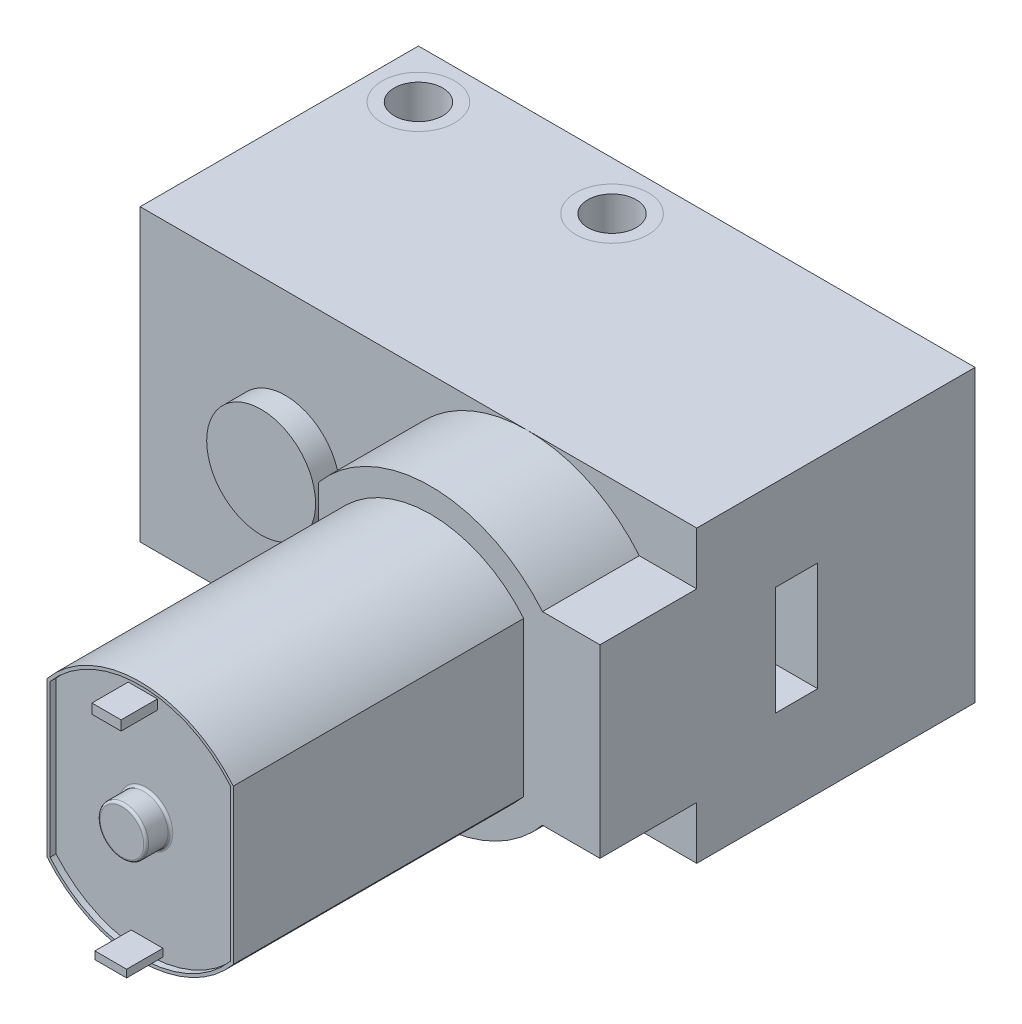
from build123d import *

# Parameters (mm, degrees)
SKETCH_1_W            = 46
SKETCH_1_H            = 23
EXTRUDE_1_DEPTH       = 24
EXTRUDE_2_DEPTH       = 8
EXTRUDE_3_DEPTH       = 24
SKETCH_4_R            = 4.5
SKETCH_4_R_2          = 2
EXTRUDE_4_DEPTH       = 2
SKETCH_6_W            = 3.5
SKETCH_6_H            = 9
CUT_EXTRUDE_1_DEPTH   = 5
SKETCH_7_R            = 2.7
EXTRUDE_5_DEPTH       = 2
EXTRUDE_6_DEPTH       = 7
SKETCH_9_R            = 1.25
CUT_EXTRUDE_2_DEPTH   = 5
SKETCH_10_R           = 3
CUT_EXTRUDE_3_DEPTH   = 8
CUT_EXTRUDE_START     = -16
SKETCH_10_2_R         = 3
CUT_EXTRUDE_4_DEPTH   = 8
SKETCH_11_R           = 2
CUT_EXTRUDE_5_DEPTH   = 8
SKETCH1_R             = 3
SKETCH1_R_2           = 2
BOSS_EXTRUDE1_DEPTH   = 8
BOSS_EXTRUDE1_2_DEPTH = 8
BOSS_EXTRUDE2_START   = -24
SKETCH1_2_R           = 3
SKETCH1_2_R_2         = 2
BOSS_EXTRUDE2_DEPTH   = 8
BOSS_EXTRUDE2_2_DEPTH = 8
CUT_EXTRUDE1_DEPTH    = 0.5
SKETCH3_R             = 2
BOSS_EXTRUDE3_DEPTH   = 2
FILLET1_R             = 0.2
SKETCH4_W             = 2.412078278
SKETCH4_H             = 0.804026092
SKETCH4_W_2           = 2.621824216
SKETCH4_H_2           = 0.629237812
BOSS_EXTRUDE4_DEPTH   = 3


with BuildPart() as part:
    # 草图1 → 凸台-拉伸1 (new body)
    with BuildSketch(Plane(origin=(0, 0, 0), x_dir=(1, 0, 0), z_dir=(0, 1, 0))):
        Rectangle(SKETCH_1_W, SKETCH_1_H)
    extrude(amount=EXTRUDE_1_DEPTH)

    # 草图2 → 凸台-拉伸2 (add)
    with BuildSketch(Plane.XY.offset(11.5)):
        with BuildLine():
            Line((-0.25, 19.644442426), (-0.25, 4.355557574))
            ThreePointArc((-0.25, 4.355557574), (9, 0), (18.25, 4.355557574))
            Line((18.25, 4.355557574), (23, 4.355557574))
            Line((23, 4.355557574), (23, 19.644442426))
            Line((23, 19.644442426), (18.25, 19.644442426))
            ThreePointArc((18.25, 19.644442426), (9, 24), (-0.25, 19.644442426))
        make_face()
    extrude(amount=EXTRUDE_2_DEPTH)

    # 草图3 → 凸台-拉伸3 (add)
    with BuildSketch(Plane.XY.offset(19.5)):
        with BuildLine():
            Line((1.3, 18.380438856), (1.3, 5.619561144))
            ThreePointArc((1.3, 5.619561144), (9, 2), (16.7, 5.619561144))
            Line((16.7, 5.619561144), (16.7, 18.380438856))
            ThreePointArc((16.7, 18.380438856), (9, 22), (1.3, 18.380438856))
        make_face()
    extrude(amount=EXTRUDE_3_DEPTH)

    # 草图4 → 凸台-拉伸4 (add)
    with BuildSketch(Plane.XY.offset(11.5)):
        with Locations(Location((-11, 12, 0), (0, 0, 180))):
            Circle(SKETCH_4_R)
        with Locations((-0.25, 12)):
            Circle(SKETCH_4_R_2)
    extrude(amount=EXTRUDE_4_DEPTH)

    # 草图6 → 切除-拉伸1 (cut)
    with BuildSketch(Plane(origin=(23, 0, 0), x_dir=(0, 0, -1), z_dir=(1, 0, 0))):
        with Locations((-3.25, 12)):
            Rectangle(SKETCH_6_W, SKETCH_6_H)
    extrude(amount=-CUT_EXTRUDE_1_DEPTH, mode=Mode.SUBTRACT)

    # 草图7 → 凸台-拉伸5 (add)
    with BuildSketch(Plane(origin=(0, 0, -11.5), x_dir=(-1, 0, 0), z_dir=(0, 0, -1))):
        with Locations(Location((11, 12, 0), (0, 0, 180))):
            Circle(SKETCH_7_R)
    extrude(amount=EXTRUDE_5_DEPTH)

    # 草图8 → 凸台-拉伸6 (add)
    with BuildSketch(Plane(origin=(0, 0, -13.5), x_dir=(-1, 0, 0), z_dir=(0, 0, -1))):
        with BuildLine():
            Line((9.25, 14.056088519), (9.25, 9.943911481))
            ThreePointArc((9.25, 9.943911481), (11, 9.3), (12.75, 9.943911481))
            Line((12.75, 9.943911481), (12.75, 14.056088519))
            ThreePointArc((12.75, 14.056088519), (11, 14.7), (9.25, 14.056088519))
        make_face()
    extrude(amount=EXTRUDE_6_DEPTH)

    # 草图9 → 切除-拉伸2 (cut)
    with BuildSketch(Plane(origin=(0, 0, -20.5), x_dir=(-1, 0, 0), z_dir=(0, 0, -1))):
        with Locations((11, 12)):
            Circle(SKETCH_9_R)
    extrude(amount=-CUT_EXTRUDE_2_DEPTH, mode=Mode.SUBTRACT)

    # 草图10 → 切除-拉伸3 (cut)
    with BuildSketch(Plane(origin=(0, 24, 0), x_dir=(1, 0, 0), z_dir=(0, 1, 0))):
        with Locations(Location((-19, 7.5, 0), (0, 0, 270))):
            Circle(SKETCH_10_R)
        with Locations(Location((-3, 7.5, 0), (0, 0, 270))):
            Circle(SKETCH_10_R)
    extrude(amount=-CUT_EXTRUDE_3_DEPTH, mode=Mode.SUBTRACT)

    # 草图10<2> → 切除-拉伸4 (cut)
    with BuildSketch(Plane(origin=(0, 24, 0), x_dir=(1, 0, 0), z_dir=(0, 1, 0)).offset(CUT_EXTRUDE_START)):
        with Locations(Location((-19, 7.5, 0), (0, 0, 270))):
            Circle(SKETCH_10_2_R)
        with Locations(Location((-3, 7.5, 0), (0, 0, 270))):
            Circle(SKETCH_10_2_R)
    extrude(amount=-CUT_EXTRUDE_4_DEPTH, mode=Mode.SUBTRACT)

    # 草图11 → 切除-拉伸5 (cut)
    with BuildSketch(Plane(origin=(0, 0, -11.5), x_dir=(-1, 0, 0), z_dir=(0, 0, -1))):
        with Locations((-13, 20)):
            Circle(SKETCH_11_R)
        with Locations((-13, 4)):
            Circle(SKETCH_11_R)
    extrude(amount=-CUT_EXTRUDE_5_DEPTH, mode=Mode.SUBTRACT)

    # Sketch2 → Cut-Extrude1 (cut)
    with BuildSketch(Plane.XY.offset(43.5)):
        with BuildLine():
            Line((16.45, 5.710325923), (16.45, 18.289674077))
            ThreePointArc((16.45, 18.289674077), (9, 21.75), (1.55, 18.289674077))
            Line((1.55, 18.289674077), (1.55, 5.710325923))
            ThreePointArc((1.55, 5.710325923), (9, 2.25), (16.45, 5.710325923))
        make_face()
    extrude(amount=-CUT_EXTRUDE1_DEPTH, mode=Mode.SUBTRACT)

    # Sketch3 → Boss-Extrude3 (add)
    with BuildSketch(Plane.XY.offset(43)):
        with Locations((9, 12)):
            Circle(SKETCH3_R)
    extrude(amount=BOSS_EXTRUDE3_DEPTH)

    # Fillet1
    fillet1_edges = [part.edges().sort_by_distance(p)[0] for p in [
        (7, 12, 43),
        (7, 12, 45),
    ]]
    fillet(fillet1_edges, radius=FILLET1_R)

    # Sketch4 → Boss-Extrude4 (add)
    with BuildSketch(Plane.XY.offset(43)):
        with Locations((8.721935224, 20.582104599)):
            Rectangle(SKETCH4_W, SKETCH4_H)
        with Locations((9.071511786, 3.050840011)):
            Rectangle(SKETCH4_W_2, SKETCH4_H_2)
    extrude(amount=BOSS_EXTRUDE4_DEPTH)


with BuildPart() as body_2:
    # Sketch1 → Boss-Extrude1 (new body)
    with BuildSketch(Plane(origin=(0, 24, 0), x_dir=(1, 0, 0), z_dir=(0, 1, 0))):
        with Locations(Location((-3, 7.5, 0), (0, 0, 270))):
            Circle(SKETCH1_R)
        with Locations(Location((-3, 7.5, 0), (0, 0, 270))):
            Circle(SKETCH1_R_2, mode=Mode.SUBTRACT)
    extrude(amount=-BOSS_EXTRUDE1_DEPTH)


with BuildPart() as body_3:
    # Sketch1 → Boss-Extrude1 2 (new body)
    with BuildSketch(Plane(origin=(0, 24, 0), x_dir=(1, 0, 0), z_dir=(0, 1, 0))):
        with Locations(Location((-19, 7.5, 0), (0, 0, 270))):
            Circle(SKETCH1_R)
        with Locations(Location((-19, 7.5, 0), (0, 0, 270))):
            Circle(SKETCH1_R_2, mode=Mode.SUBTRACT)
    extrude(amount=-BOSS_EXTRUDE1_2_DEPTH)


with BuildPart() as body_4:
    # Sketch1<2> → Boss-Extrude2 (new body)
    with BuildSketch(Plane(origin=(0, 24, 0), x_dir=(1, 0, 0), z_dir=(0, 1, 0)).offset(BOSS_EXTRUDE2_START)):
        with Locations(Location((-3, 7.5, 0), (0, 0, 90))):
            Circle(SKETCH1_2_R)
        with Locations(Location((-3, 7.5, 0), (0, 0, 90))):
            Circle(SKETCH1_2_R_2, mode=Mode.SUBTRACT)
    extrude(amount=BOSS_EXTRUDE2_DEPTH)


with BuildPart() as body_5:
    # Sketch1<2> → Boss-Extrude2 2 (new body)
    with BuildSketch(Plane(origin=(0, 24, 0), x_dir=(1, 0, 0), z_dir=(0, 1, 0)).offset(BOSS_EXTRUDE2_START)):
        with Locations(Location((-19, 7.5, 0), (0, 0, 90))):
            Circle(SKETCH1_2_R)
        with Locations(Location((-19, 7.5, 0), (0, 0, 90))):
            Circle(SKETCH1_2_R_2, mode=Mode.SUBTRACT)
    extrude(amount=BOSS_EXTRUDE2_2_DEPTH)


solid = Compound([part.part, body_2.part, body_3.part, body_4.part, body_5.part])
